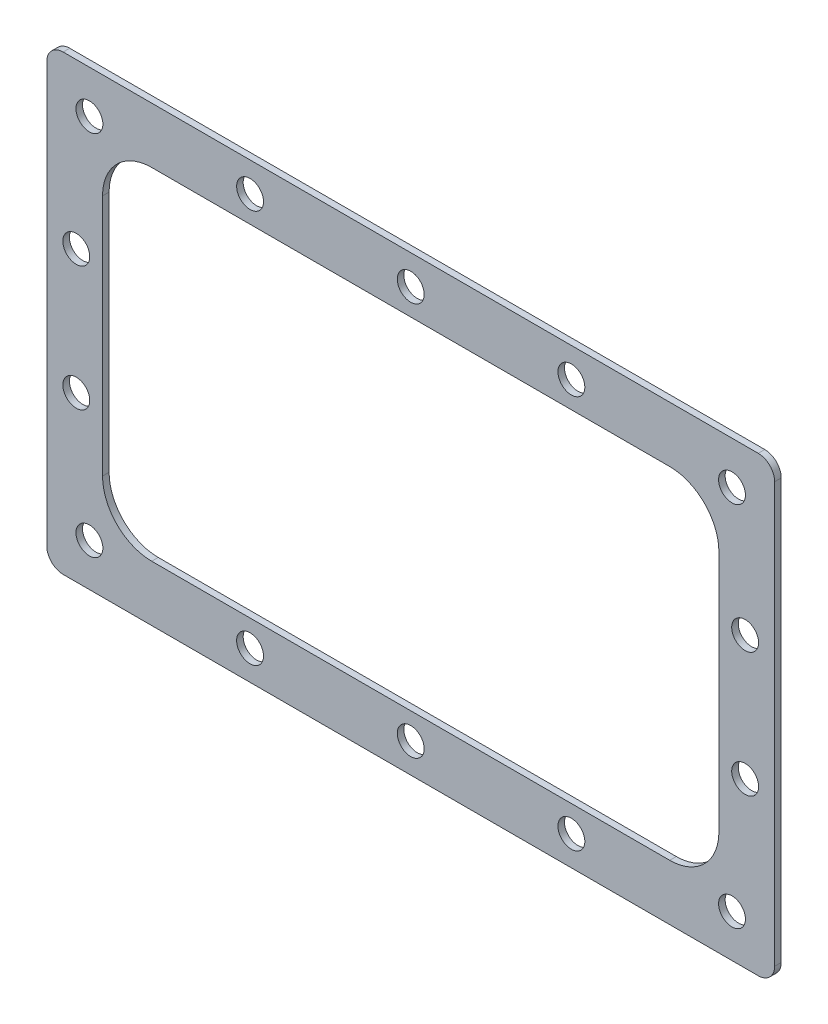
from build123d import *

# Parameters (mm, degrees)
SKETCH1_W           = 112
SKETCH1_H           = 70
BOSS_EXTRUDE1_DEPTH = 1
FILLET1_R           = 3
SKETCH3_W           = 94
SKETCH3_H           = 52
CUT_EXTRUDE2_DEPTH  = 67.045438904
FILLET2_R           = 7.5
CUT_EXTRUDE3_REACH  = 68.045
SKETCH4_R           = 1.6
SKETCH5_R           = 2.05
CUT_EXTRUDE4_DEPTH  = 67.045438904
SKETCH6_W           = 132
SKETCH6_H           = 90
CUT_EXTRUDE5_DEPTH  = 67.045438904


with BuildPart() as part:
    # Sketch1 → Boss-Extrude1 (new body)
    with BuildSketch(Plane.XY):
        Rectangle(SKETCH1_W, SKETCH1_H)
    extrude(amount=BOSS_EXTRUDE1_DEPTH)

    # Fillet1
    fillet1_edges = [part.edges().sort_by_distance(p)[0] for p in [
        (-56, -35, 0.5),
        (-56, 35, 0.5),
        (56, -35, 0.5),
        (56, 35, 0.5),
    ]]
    fillet(fillet1_edges, radius=FILLET1_R)

    # Sketch3 → Cut-Extrude2 (cut, through all)
    with BuildSketch(Plane(origin=(0, 0, 0), x_dir=(-1, 0, 0), z_dir=(0, 0, -1))):
        Rectangle(SKETCH3_W, SKETCH3_H)
    extrude(amount=-CUT_EXTRUDE2_DEPTH, mode=Mode.SUBTRACT)

    # Fillet2
    fillet2_edges = [part.edges().sort_by_distance(p)[0] for p in [
        (47, -26, 0.5),
        (47, 26, 0.5),
        (-47, -26, 0.5),
        (-47, 26, 0.5),
    ]]
    fillet(fillet2_edges, radius=FILLET2_R)

    # Sketch4 → Cut-Extrude3 (cut, up to next)
    with BuildSketch(Plane(origin=(0, 0, 0), x_dir=(-1, 0, 0), z_dir=(0, 0, -1)), mode=Mode.PRIVATE) as cut_extrude3_sk1:
        with Locations((49, -28)):
            Circle(SKETCH4_R)
    cut_extrude3_tool1 = extrude(cut_extrude3_sk1.sketch, amount=-CUT_EXTRUDE3_REACH, mode=Mode.PRIVATE) & part.part
    # Sketch4 → Cut-Extrude3 (cut, up to next)
    with BuildSketch(Plane(origin=(0, 0, 0), x_dir=(-1, 0, 0), z_dir=(0, 0, -1)), mode=Mode.PRIVATE) as cut_extrude3_sk2:
        with Locations((24.5, -30)):
            Circle(SKETCH4_R)
    cut_extrude3_tool2 = extrude(cut_extrude3_sk2.sketch, amount=-CUT_EXTRUDE3_REACH, mode=Mode.PRIVATE) & part.part
    # Sketch4 → Cut-Extrude3 (cut, up to next)
    with BuildSketch(Plane(origin=(0, 0, 0), x_dir=(-1, 0, 0), z_dir=(0, 0, -1)), mode=Mode.PRIVATE) as cut_extrude3_sk3:
        with Locations((0, -30)):
            Circle(SKETCH4_R)
    cut_extrude3_tool3 = extrude(cut_extrude3_sk3.sketch, amount=-CUT_EXTRUDE3_REACH, mode=Mode.PRIVATE) & part.part
    # Sketch4 → Cut-Extrude3 (cut, up to next)
    with BuildSketch(Plane(origin=(0, 0, 0), x_dir=(-1, 0, 0), z_dir=(0, 0, -1)), mode=Mode.PRIVATE) as cut_extrude3_sk4:
        with Locations((-24.5, -30)):
            Circle(SKETCH4_R)
    cut_extrude3_tool4 = extrude(cut_extrude3_sk4.sketch, amount=-CUT_EXTRUDE3_REACH, mode=Mode.PRIVATE) & part.part
    # Sketch4 → Cut-Extrude3 (cut, up to next)
    with BuildSketch(Plane(origin=(0, 0, 0), x_dir=(-1, 0, 0), z_dir=(0, 0, -1)), mode=Mode.PRIVATE) as cut_extrude3_sk5:
        with Locations((-49, -28)):
            Circle(SKETCH4_R)
    cut_extrude3_tool5 = extrude(cut_extrude3_sk5.sketch, amount=-CUT_EXTRUDE3_REACH, mode=Mode.PRIVATE) & part.part
    # Sketch4 → Cut-Extrude3 (cut, up to next)
    with BuildSketch(Plane(origin=(0, 0, 0), x_dir=(-1, 0, 0), z_dir=(0, 0, -1)), mode=Mode.PRIVATE) as cut_extrude3_sk6:
        with Locations((-51, -9.5)):
            Circle(SKETCH4_R)
    cut_extrude3_tool6 = extrude(cut_extrude3_sk6.sketch, amount=-CUT_EXTRUDE3_REACH, mode=Mode.PRIVATE) & part.part
    # Sketch4 → Cut-Extrude3 (cut, up to next)
    with BuildSketch(Plane(origin=(0, 0, 0), x_dir=(-1, 0, 0), z_dir=(0, 0, -1)), mode=Mode.PRIVATE) as cut_extrude3_sk7:
        with Locations((-51, 9.5)):
            Circle(SKETCH4_R)
    cut_extrude3_tool7 = extrude(cut_extrude3_sk7.sketch, amount=-CUT_EXTRUDE3_REACH, mode=Mode.PRIVATE) & part.part
    # Sketch4 → Cut-Extrude3 (cut, up to next)
    with BuildSketch(Plane(origin=(0, 0, 0), x_dir=(-1, 0, 0), z_dir=(0, 0, -1)), mode=Mode.PRIVATE) as cut_extrude3_sk8:
        with Locations((-49, 28)):
            Circle(SKETCH4_R)
    cut_extrude3_tool8 = extrude(cut_extrude3_sk8.sketch, amount=-CUT_EXTRUDE3_REACH, mode=Mode.PRIVATE) & part.part
    # Sketch4 → Cut-Extrude3 (cut, up to next)
    with BuildSketch(Plane(origin=(0, 0, 0), x_dir=(-1, 0, 0), z_dir=(0, 0, -1)), mode=Mode.PRIVATE) as cut_extrude3_sk9:
        with Locations((-24.5, 30)):
            Circle(SKETCH4_R)
    cut_extrude3_tool9 = extrude(cut_extrude3_sk9.sketch, amount=-CUT_EXTRUDE3_REACH, mode=Mode.PRIVATE) & part.part
    # Sketch4 → Cut-Extrude3 (cut, up to next)
    with BuildSketch(Plane(origin=(0, 0, 0), x_dir=(-1, 0, 0), z_dir=(0, 0, -1)), mode=Mode.PRIVATE) as cut_extrude3_sk10:
        with Locations((0, 30)):
            Circle(SKETCH4_R)
    cut_extrude3_tool10 = extrude(cut_extrude3_sk10.sketch, amount=-CUT_EXTRUDE3_REACH, mode=Mode.PRIVATE) & part.part
    # Sketch4 → Cut-Extrude3 (cut, up to next)
    with BuildSketch(Plane(origin=(0, 0, 0), x_dir=(-1, 0, 0), z_dir=(0, 0, -1)), mode=Mode.PRIVATE) as cut_extrude3_sk11:
        with Locations((24.5, 30)):
            Circle(SKETCH4_R)
    cut_extrude3_tool11 = extrude(cut_extrude3_sk11.sketch, amount=-CUT_EXTRUDE3_REACH, mode=Mode.PRIVATE) & part.part
    # Sketch4 → Cut-Extrude3 (cut, up to next)
    with BuildSketch(Plane(origin=(0, 0, 0), x_dir=(-1, 0, 0), z_dir=(0, 0, -1)), mode=Mode.PRIVATE) as cut_extrude3_sk12:
        with Locations((49, 28)):
            Circle(SKETCH4_R)
    cut_extrude3_tool12 = extrude(cut_extrude3_sk12.sketch, amount=-CUT_EXTRUDE3_REACH, mode=Mode.PRIVATE) & part.part
    # Sketch4 → Cut-Extrude3 (cut, up to next)
    with BuildSketch(Plane(origin=(0, 0, 0), x_dir=(-1, 0, 0), z_dir=(0, 0, -1)), mode=Mode.PRIVATE) as cut_extrude3_sk13:
        with Locations((51, 9.5)):
            Circle(SKETCH4_R)
    cut_extrude3_tool13 = extrude(cut_extrude3_sk13.sketch, amount=-CUT_EXTRUDE3_REACH, mode=Mode.PRIVATE) & part.part
    # Sketch4 → Cut-Extrude3 (cut, up to next)
    with BuildSketch(Plane(origin=(0, 0, 0), x_dir=(-1, 0, 0), z_dir=(0, 0, -1)), mode=Mode.PRIVATE) as cut_extrude3_sk14:
        with Locations((51, -9.5)):
            Circle(SKETCH4_R)
    cut_extrude3_tool14 = extrude(cut_extrude3_sk14.sketch, amount=-CUT_EXTRUDE3_REACH, mode=Mode.PRIVATE) & part.part
    add(cut_extrude3_tool1.solids().sort_by_distance((-49, -28, 0))[0], mode=Mode.SUBTRACT)
    add(cut_extrude3_tool2.solids().sort_by_distance((-24.5, -30, 0))[0], mode=Mode.SUBTRACT)
    add(cut_extrude3_tool3.solids().sort_by_distance((0, -30, 0))[0], mode=Mode.SUBTRACT)
    add(cut_extrude3_tool4.solids().sort_by_distance((24.5, -30, 0))[0], mode=Mode.SUBTRACT)
    add(cut_extrude3_tool5.solids().sort_by_distance((49, -28, 0))[0], mode=Mode.SUBTRACT)
    add(cut_extrude3_tool6.solids().sort_by_distance((51, -9.5, 0))[0], mode=Mode.SUBTRACT)
    add(cut_extrude3_tool7.solids().sort_by_distance((51, 9.5, 0))[0], mode=Mode.SUBTRACT)
    add(cut_extrude3_tool8.solids().sort_by_distance((49, 28, 0))[0], mode=Mode.SUBTRACT)
    add(cut_extrude3_tool9.solids().sort_by_distance((24.5, 30, 0))[0], mode=Mode.SUBTRACT)
    add(cut_extrude3_tool10.solids().sort_by_distance((0, 30, 0))[0], mode=Mode.SUBTRACT)
    add(cut_extrude3_tool11.solids().sort_by_distance((-24.5, 30, 0))[0], mode=Mode.SUBTRACT)
    add(cut_extrude3_tool12.solids().sort_by_distance((-49, 28, 0))[0], mode=Mode.SUBTRACT)
    add(cut_extrude3_tool13.solids().sort_by_distance((-51, 9.5, 0))[0], mode=Mode.SUBTRACT)
    add(cut_extrude3_tool14.solids().sort_by_distance((-51, -9.5, 0))[0], mode=Mode.SUBTRACT)

    # Sketch5 → Cut-Extrude4 (cut, through all)
    with BuildSketch(Plane.XY.offset(1)):
        with Locations((-49, 28)):
            Circle(SKETCH5_R)
        with Locations((-24.5, 30)):
            Circle(SKETCH5_R)
        with Locations((0, 30)):
            Circle(SKETCH5_R)
        with Locations((24.5, 30)):
            Circle(SKETCH5_R)
        with Locations((49, 28)):
            Circle(SKETCH5_R)
        with Locations((51, 9.5)):
            Circle(SKETCH5_R)
        with Locations((51, -9.5)):
            Circle(SKETCH5_R)
        with Locations((49, -28)):
            Circle(SKETCH5_R)
        with Locations((24.5, -30)):
            Circle(SKETCH5_R)
        with Locations((0, -30)):
            Circle(SKETCH5_R)
        with Locations((-24.5, -30)):
            Circle(SKETCH5_R)
        with Locations((-49, -28)):
            Circle(SKETCH5_R)
        with Locations((-51, -9.5)):
            Circle(SKETCH5_R)
        with Locations((-51, 9.5)):
            Circle(SKETCH5_R)
    extrude(amount=-CUT_EXTRUDE4_DEPTH, mode=Mode.SUBTRACT)

    # Sketch6 → Cut-Extrude5 (cut, through all)
    with BuildSketch(Plane.XY.offset(1)):
        Rectangle(SKETCH6_W, SKETCH6_H)
        with BuildLine():
            Line((-53, 34.5), (53, 34.5))
            ThreePointArc((53, 34.5), (54.767766953, 33.767766953), (55.5, 32))
            Line((55.5, 32), (55.5, -32))
            ThreePointArc((55.5, -32), (54.767766953, -33.767766953), (53, -34.5))
            Line((53, -34.5), (-53, -34.5))
            ThreePointArc((-53, -34.5), (-54.767766953, -33.767766953), (-55.5, -32))
            Line((-55.5, -32), (-55.5, 32))
            ThreePointArc((-55.5, 32), (-54.767766953, 33.767766953), (-53, 34.5))
        make_face(mode=Mode.SUBTRACT)
    extrude(amount=-CUT_EXTRUDE5_DEPTH, mode=Mode.SUBTRACT)


solid = part.part
